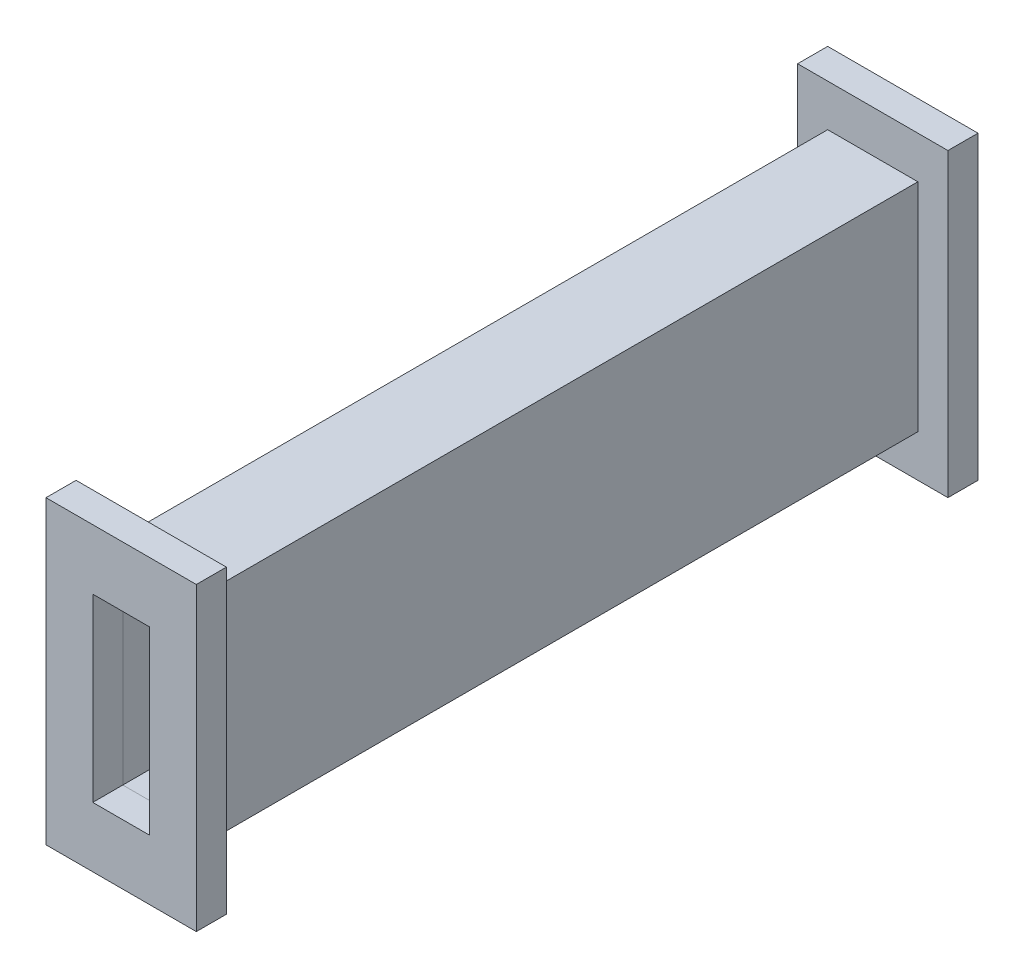
from build123d import *

# Parameters (mm, degrees)
SKETCH2_W           = 15
SKETCH2_H           = 36
SKETCH2_W_2         = 9.45
SKETCH2_H_2         = 30
BOSS_EXTRUDE1_DEPTH = 60
SKETCH3_W           = 25
SKETCH3_H           = 50
SKETCH3_W_2         = 9.45
SKETCH3_H_2         = 30
BOSS_EXTRUDE2_DEPTH = 5


with BuildPart() as part:
    # Sketch2 → Boss-Extrude1 (new, symmetric)
    with BuildSketch(Plane.XY):
        Rectangle(SKETCH2_W, SKETCH2_H)
        Rectangle(SKETCH2_W_2, SKETCH2_H_2, mode=Mode.SUBTRACT)
    extrude(amount=BOSS_EXTRUDE1_DEPTH, both=True)


with BuildPart() as body_2:
    # Sketch3 → Boss-Extrude2 (new body)
    with BuildSketch(Plane.XY.offset(60)):
        Rectangle(SKETCH3_W, SKETCH3_H)
        Rectangle(SKETCH3_W_2, SKETCH3_H_2, mode=Mode.SUBTRACT)
    boss_extrude2 = extrude(amount=BOSS_EXTRUDE2_DEPTH)


with BuildPart() as part_1:
    add(part.part)

    # Mirror2: Boss-Extrude2 across plane
    add(boss_extrude2.mirror(Plane.XY))


solid = Compound([body_2.part, part_1.part])
